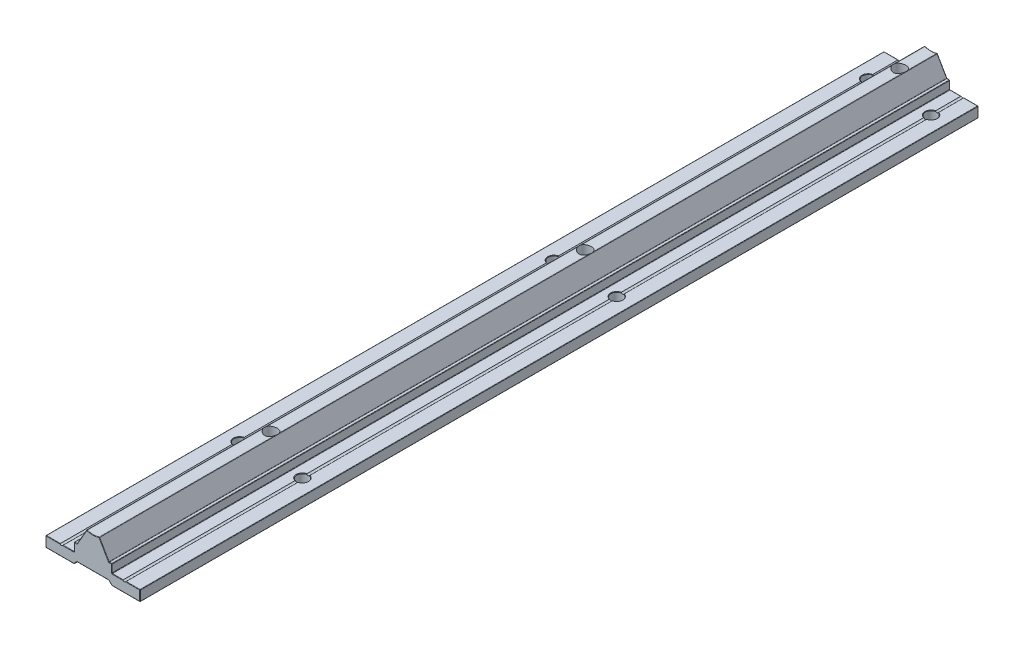
from build123d import *

# Parameters (mm, degrees)
BOSS_EXTRUDE1_DEPTH        = 400
FILLET1_R                  = 0.2
CUT_EXTRUDE1_REACH         = 402.991
SKETCH2_R                  = 2.75
CHAMFER1_SIZE              = 0.2
LPATTERN1_COUNT            = 3
LPATTERN1_PITCH            = 150
CHAMFER1_OF_LPATTERN1_SIZE = 0.2
SKETCH3_R                  = 3
CUT_EXTRUDE2_DEPTH         = 401.930580196
SKETCH4_R                  = 5
CUT_EXTRUDE3_DEPTH         = 6
LPATTERN2_COUNT            = 3
LPATTERN2_PITCH            = 150
SKETCH5_R                  = 0.8
CUT_EXTRUDE6_DEPTH         = 401.99283036


with BuildPart() as part:
    # Sketch1 → Boss-Extrude1 (new body)
    with BuildSketch(Plane.XY):
        with BuildLine():
            Line((-3, 0), (-7.618802154, -8))
            Line((-7.618802154, -8), (-9, -8))
            Line((-9, -8), (-9, -12))
            Line((-9, -12), (-22.5, -12))
            Line((-22.5, -12), (-22.5, -17))
            Line((-22.5, -17), (-9, -17))
            Line((-9, -17), (-7.618802154, -15.5))
            Line((-7.618802154, -15.5), (7.618802154, -15.5))
            Line((7.618802154, -15.5), (9, -17))
            Line((9, -17), (22.5, -17))
            Line((22.5, -17), (22.5, -12))
            Line((22.5, -12), (9, -12))
            Line((9, -12), (9, -8))
            Line((9, -8), (7.618802154, -8))
            Line((7.618802154, -8), (3, 0))
            ThreePointArc((3, 0), (0, -0.460607986), (-3, 0))
        make_face()
    extrude(amount=BOSS_EXTRUDE1_DEPTH)

    # Fillet1
    fillet1_edges = [part.edges().sort_by_distance(p)[0] for p in [
        (0, -15.5, 400),
        (8.309401077, -16.25, 400),
        (-22.5, -14.5, 0),
        (-15.75, -12, 0),
        (-9, -10, 0),
        (-8.309401077, -8, 0),
        (-5.309401077, -4, 0),
        (15.75, -17, 400),
        (0, -0.460607986, 0),
        (5.309401077, -4, 0),
        (8.309401077, -8, 0),
        (9, -10, 0),
        (15.75, -12, 0),
        (22.5, -14.5, 0),
        (15.75, -17, 0),
        (8.309401077, -16.25, 0),
        (22.5, -14.5, 400),
        (0, -15.5, 0),
        (-8.309401077, -16.25, 0),
        (-15.75, -17, 0),
        (15.75, -12, 400),
        (9, -10, 400),
        (-22.5, -17, 200),
        (-22.5, -12, 200),
        (-9, -12, 200),
        (-9, -8, 200),
        (-7.618802154, -8, 200),
        (-3, 0, 200),
        (3, 0, 200),
        (7.618802154, -8, 200),
        (9, -8, 200),
        (9, -12, 200),
        (22.5, -12, 200),
        (22.5, -17, 200),
        (9, -17, 200),
        (7.618802154, -15.5, 200),
        (-7.618802154, -15.5, 200),
        (-9, -17, 200),
        (8.309401077, -8, 400),
        (5.309401077, -4, 400),
        (0, -0.460607986, 400),
        (-5.309401077, -4, 400),
        (-15.75, -17, 400),
        (-8.309401077, -8, 400),
        (-9, -10, 400),
        (-15.75, -12, 400),
        (-22.5, -14.5, 400),
        (-8.309401077, -16.25, 400),
    ]]
    fillet(fillet1_edges, radius=FILLET1_R)

    # Sketch2 → Cut-Extrude1 (cut, up to next)
    with BuildSketch(Plane.XZ.offset(17), mode=Mode.PRIVATE) as cut_extrude1_sk1:
        with Locations((-15, 15)):
            Circle(SKETCH2_R)
    cut_extrude1_tool1 = extrude(cut_extrude1_sk1.sketch, amount=-CUT_EXTRUDE1_REACH, mode=Mode.PRIVATE) & part.part
    # Sketch2 → Cut-Extrude1 (cut, up to next)
    with BuildSketch(Plane.XZ.offset(17), mode=Mode.PRIVATE) as cut_extrude1_sk2:
        with Locations((15, 15)):
            Circle(SKETCH2_R)
    cut_extrude1_tool2 = extrude(cut_extrude1_sk2.sketch, amount=-CUT_EXTRUDE1_REACH, mode=Mode.PRIVATE) & part.part
    cut_extrude1_1 = cut_extrude1_tool1.solids().sort_by_distance((-15, -17, 15))[0]
    add(cut_extrude1_1, mode=Mode.SUBTRACT)
    cut_extrude1_2 = cut_extrude1_tool2.solids().sort_by_distance((15, -17, 15))[0]
    add(cut_extrude1_2, mode=Mode.SUBTRACT)
    cut_extrude1 = cut_extrude1_1 + cut_extrude1_2  # Cut-Extrude1 as one shape, for the pattern or mirror that repeats it

    # Chamfer1
    chamfer1_edges = [part.edges().sort_by_distance(p)[0] for p in [
        (-17.75, -17, 15),
        (-17.75, -12, 15),
        (12.25, -17, 15),
        (12.25, -12, 15),
    ]]
    chamfer(chamfer1_edges, length=CHAMFER1_SIZE)

    # LPattern1: Cut-Extrude1 ×3
    with Locations(*[(0, 0, i * LPATTERN1_PITCH) for i in range(1, LPATTERN1_COUNT)]):
        add(cut_extrude1, mode=Mode.SUBTRACT)

    # Chamfer1 of LPattern1
    chamfer1_of_lpattern1_edges = [part.edges().sort_by_distance(p)[0] for p in [
        (-17.75, -17, 165),
        (-17.75, -12, 165),
        (12.25, -17, 165),
        (12.25, -12, 165),
        (-17.75, -17, 315),
        (-17.75, -12, 315),
        (12.25, -17, 315),
        (12.25, -12, 315),
    ]]
    chamfer(chamfer1_of_lpattern1_edges, length=CHAMFER1_OF_LPATTERN1_SIZE)

    # Sketch3 → Cut-Extrude2 (cut, through all)
    with BuildSketch(Plane.XZ.offset(15.5)):
        with Locations((0, 15)):
            Circle(SKETCH3_R)
    cut_extrude2 = extrude(amount=-CUT_EXTRUDE2_DEPTH, mode=Mode.SUBTRACT)

    # Sketch4 → Cut-Extrude3 (cut)
    with BuildSketch(Plane.XZ.offset(15.5)):
        with Locations((0, 15)):
            Circle(SKETCH4_R)
    cut_extrude3 = extrude(amount=-CUT_EXTRUDE3_DEPTH, mode=Mode.SUBTRACT)

    # LPattern2: Cut-Extrude2, Cut-Extrude3 ×3
    with Locations(*[(0, 0, i * LPATTERN2_PITCH) for i in range(1, LPATTERN2_COUNT)]):
        add(cut_extrude2, mode=Mode.SUBTRACT)
        add(cut_extrude3, mode=Mode.SUBTRACT)

    # Sketch5 → Cut-Extrude6 (cut, through all)
    with BuildSketch(Plane.XY):
        with Locations((-15, -11.6)):
            Circle(SKETCH5_R)
        with Locations((15, -11.6)):
            Circle(SKETCH5_R)
    extrude(amount=CUT_EXTRUDE6_DEPTH, mode=Mode.SUBTRACT)


solid = part.part
